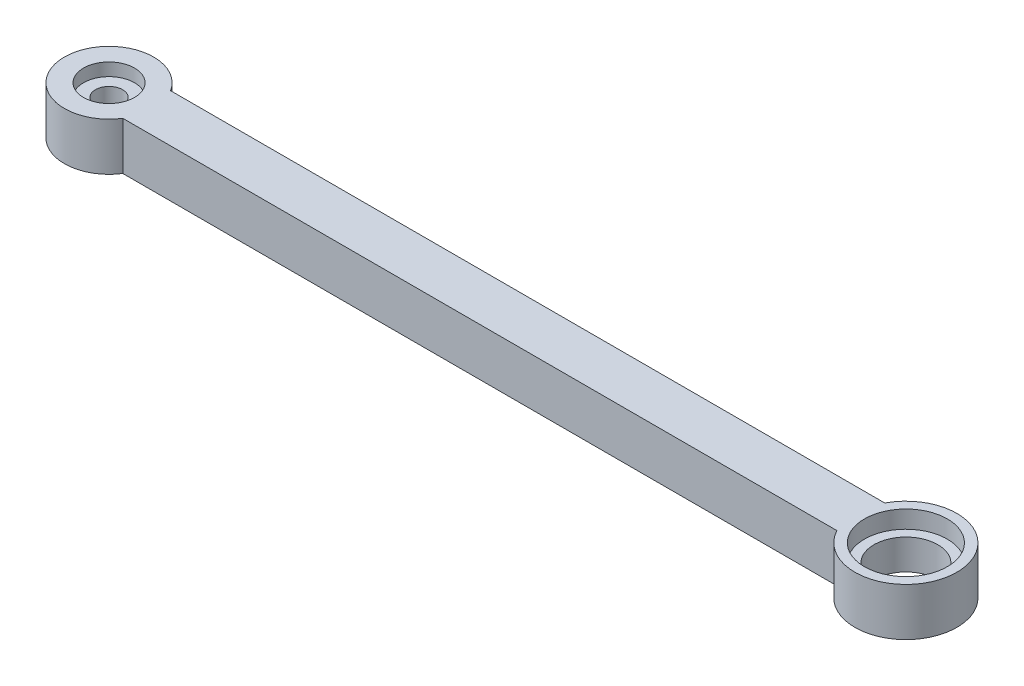
from build123d import *

# Parameters (mm, degrees)
SKETCH2_R                             = 14
SKETCH2_R_2                           = 8
BOSS_EXTRUDE7_DEPTH                   = 15
SKETCH2_9_R                           = 16
SKETCH2_9_R_2                         = 13
BOSS_EXTRUDE8_DEPTH                   = 15
SKETCH2_11_R                          = 13
SKETCH2_11_R_2                        = 10
BOSS_EXTRUDE9_DEPTH                   = 9.5
BOSS_EXTRUDE11_REACH                  = 219.372
BOSS_EXTRUDE11_END_RADIUS             = 14
BOSS_EXTRUDE11_DIRECTION_2_REACH      = 219.372
BOSS_EXTRUDE11_DIRECTION_2_END_RADIUS = 16
BOSS_EXTRUDE12_REACH                  = 219.489
SKETCH15_W                            = 3
SKETCH15_H                            = 9.5
FILLET1_R                             = 2
SKETCH2_13_R                          = 8
SKETCH2_13_R_2                        = 4.25
BOSS_EXTRUDE13_DEPTH                  = 11


with BuildPart() as part:
    # Sketch2 → Boss-Extrude7 (new body)
    with BuildSketch(Plane(origin=(0, 0, 0), x_dir=(1, 0, 0), z_dir=(0, 1, 0))):
        with Locations(Location((-50, 3.220631283, 0), (0, 0, 270))):
            Circle(SKETCH2_R)
        with Locations(Location((-50, 3.220631283, 0), (0, 0, 270))):
            Circle(SKETCH2_R_2, mode=Mode.SUBTRACT)
    extrude(amount=BOSS_EXTRUDE7_DEPTH)


with BuildPart() as body_2:
    # Sketch2<9> → Boss-Extrude8 (new body)
    with BuildSketch(Plane(origin=(0, 0, 0), x_dir=(1, 0, 0), z_dir=(0, 1, 0))):
        with Locations(Location((200, 3.220631283, 0), (0, 0, 270))):
            Circle(SKETCH2_9_R)
        with Locations(Location((200, 3.220631283, 0), (0, 0, 270))):
            Circle(SKETCH2_9_R_2, mode=Mode.SUBTRACT)
    extrude(amount=BOSS_EXTRUDE8_DEPTH)

    # Sketch2<11> → Boss-Extrude9 (add)
    with BuildSketch(Plane(origin=(0, 0, 0), x_dir=(1, 0, 0), z_dir=(0, 1, 0))):
        with Locations(Location((200, 3.220631283, 0), (0, 0, 270))):
            Circle(SKETCH2_11_R)
        with Locations(Location((200, 3.220631283, 0), (0, 0, 270))):
            Circle(SKETCH2_11_R_2, mode=Mode.SUBTRACT)
    extrude(amount=BOSS_EXTRUDE9_DEPTH)


    add(part.part)  # Boss-Extrude11 merges part
    # Boss-Extrude11: up to this cylinder (the profile starts outside it)
    boss_extrude11_end = Plane(origin=(-50, 0.212132, -3.220631283), z_dir=(0, -1, 0)) * Cylinder(BOSS_EXTRUDE11_END_RADIUS, 467.744, mode=Mode.PRIVATE)
    # Sketch3 → Boss-Extrude11 (add, up to the surface)
    with BuildSketch(Plane(origin=(0, 0, 0), x_dir=(0, 0, -1), z_dir=(1, 0, 0)), mode=Mode.PRIVATE) as boss_extrude11_sk1:
        Polygon((10.720631283, 0), (10.720631283, 15), (-4.279368717, 15), (-4.279368717, 0), (-1.279368717, 0), (-1.279368717, 12), (7.720631283, 12), (7.720631283, 0), align=None)
    boss_extrude11_tool1 = extrude(boss_extrude11_sk1.sketch, amount=-BOSS_EXTRUDE11_REACH, mode=Mode.PRIVATE) - boss_extrude11_end
    add(boss_extrude11_tool1.solids().sort_by_distance((0, 0.212132, -9.220631))[0])

    # Boss-Extrude11 direction 2: up to this cylinder (the profile starts outside it)
    boss_extrude11_direction_2_end = Plane(origin=(200, 0.212132, -3.220631283), z_dir=(0, -1, 0)) * Cylinder(BOSS_EXTRUDE11_DIRECTION_2_END_RADIUS, 471.744, mode=Mode.PRIVATE)
    # Sketch3 → Boss-Extrude11 direction 2 (add, up to the surface)
    with BuildSketch(Plane(origin=(0, 0, 0), x_dir=(0, 0, -1), z_dir=(1, 0, 0)), mode=Mode.PRIVATE) as boss_extrude11_direction_2_sk1:
        Polygon((10.720631283, 0), (10.720631283, 15), (-4.279368717, 15), (-4.279368717, 0), (-1.279368717, 0), (-1.279368717, 12), (7.720631283, 12), (7.720631283, 0), align=None)
    boss_extrude11_direction_2_tool1 = extrude(boss_extrude11_direction_2_sk1.sketch, amount=BOSS_EXTRUDE11_DIRECTION_2_REACH, mode=Mode.PRIVATE) - boss_extrude11_direction_2_end
    add(boss_extrude11_direction_2_tool1.solids().sort_by_distance((0, 0.212132, -9.220631))[0])

    # Sketch15 → Boss-Extrude12 (add, up to next)
    with BuildSketch(Plane.XY.offset(-7.720631283), mode=Mode.PRIVATE) as boss_extrude12_sk1:
        with Locations((-14.45117452, 7.25)):
            Rectangle(SKETCH15_W, SKETCH15_H)
    boss_extrude12_tool1 = extrude(boss_extrude12_sk1.sketch, amount=BOSS_EXTRUDE12_REACH, mode=Mode.PRIVATE) - body_2.part
    # Sketch15 → Boss-Extrude12 (add, up to next)
    with BuildSketch(Plane.XY.offset(-7.720631283), mode=Mode.PRIVATE) as boss_extrude12_sk2:
        with Locations((86.457765729, 7.25)):
            Rectangle(SKETCH15_W, SKETCH15_H)
    boss_extrude12_tool2 = extrude(boss_extrude12_sk2.sketch, amount=BOSS_EXTRUDE12_REACH, mode=Mode.PRIVATE) - body_2.part
    # Sketch15 → Boss-Extrude12 (add, up to next)
    with BuildSketch(Plane.XY.offset(-7.720631283), mode=Mode.PRIVATE) as boss_extrude12_sk3:
        with Locations((10.776060542, 7.25)):
            Rectangle(SKETCH15_W, SKETCH15_H)
    boss_extrude12_tool3 = extrude(boss_extrude12_sk3.sketch, amount=BOSS_EXTRUDE12_REACH, mode=Mode.PRIVATE) - body_2.part
    # Sketch15 → Boss-Extrude12 (add, up to next)
    with BuildSketch(Plane.XY.offset(-7.720631283), mode=Mode.PRIVATE) as boss_extrude12_sk4:
        with Locations((36.003295604, 7.25)):
            Rectangle(SKETCH15_W, SKETCH15_H)
    boss_extrude12_tool4 = extrude(boss_extrude12_sk4.sketch, amount=BOSS_EXTRUDE12_REACH, mode=Mode.PRIVATE) - body_2.part
    # Sketch15 → Boss-Extrude12 (add, up to next)
    with BuildSketch(Plane.XY.offset(-7.720631283), mode=Mode.PRIVATE) as boss_extrude12_sk5:
        with Locations((61.230530666, 7.25)):
            Rectangle(SKETCH15_W, SKETCH15_H)
    boss_extrude12_tool5 = extrude(boss_extrude12_sk5.sketch, amount=BOSS_EXTRUDE12_REACH, mode=Mode.PRIVATE) - body_2.part
    # Sketch15 → Boss-Extrude12 (add, up to next)
    with BuildSketch(Plane.XY.offset(-7.720631283), mode=Mode.PRIVATE) as boss_extrude12_sk6:
        with Locations((111.685000791, 7.25)):
            Rectangle(SKETCH15_W, SKETCH15_H)
    boss_extrude12_tool6 = extrude(boss_extrude12_sk6.sketch, amount=BOSS_EXTRUDE12_REACH, mode=Mode.PRIVATE) - body_2.part
    # Sketch15 → Boss-Extrude12 (add, up to next)
    with BuildSketch(Plane.XY.offset(-7.720631283), mode=Mode.PRIVATE) as boss_extrude12_sk7:
        with Locations((136.912235853, 7.25)):
            Rectangle(SKETCH15_W, SKETCH15_H)
    boss_extrude12_tool7 = extrude(boss_extrude12_sk7.sketch, amount=BOSS_EXTRUDE12_REACH, mode=Mode.PRIVATE) - body_2.part
    # Sketch15 → Boss-Extrude12 (add, up to next)
    with BuildSketch(Plane.XY.offset(-7.720631283), mode=Mode.PRIVATE) as boss_extrude12_sk8:
        with Locations((162.139470915, 7.25)):
            Rectangle(SKETCH15_W, SKETCH15_H)
    boss_extrude12_tool8 = extrude(boss_extrude12_sk8.sketch, amount=BOSS_EXTRUDE12_REACH, mode=Mode.PRIVATE) - body_2.part
    add(boss_extrude12_tool1.solids().sort_by_distance((-14.451175, 7.25, -7.720631))[0])
    add(boss_extrude12_tool2.solids().sort_by_distance((86.457766, 7.25, -7.720631))[0])
    add(boss_extrude12_tool3.solids().sort_by_distance((10.776061, 7.25, -7.720631))[0])
    add(boss_extrude12_tool4.solids().sort_by_distance((36.003296, 7.25, -7.720631))[0])
    add(boss_extrude12_tool5.solids().sort_by_distance((61.230531, 7.25, -7.720631))[0])
    add(boss_extrude12_tool6.solids().sort_by_distance((111.685001, 7.25, -7.720631))[0])
    add(boss_extrude12_tool7.solids().sort_by_distance((136.912236, 7.25, -7.720631))[0])
    add(boss_extrude12_tool8.solids().sort_by_distance((162.139471, 7.25, -7.720631))[0])

    # Fillet1
    fillet1_edges = [body_2.edges().sort_by_distance(p)[0] for p in [
        (59.730530666, 7.25, 1.279368717),
        (62.730530666, 7.25, 1.279368717),
        (62.730530666, 7.25, -7.720631283),
        (59.730530666, 7.25, -7.720631283),
        (110.185000791, 7.25, 1.279368717),
        (113.185000791, 7.25, 1.279368717),
        (113.185000791, 7.25, -7.720631283),
        (110.185000791, 7.25, -7.720631283),
        (135.412235853, 7.25, 1.279368717),
        (138.412235853, 7.25, 1.279368717),
        (138.412235853, 7.25, -7.720631283),
        (135.412235853, 7.25, -7.720631283),
        (160.639470915, 7.25, 1.279368717),
        (163.639470915, 7.25, 1.279368717),
        (163.639470915, 7.25, -7.720631283),
        (160.639470915, 7.25, -7.720631283),
        (-15.95117452, 7.25, 1.279368717),
        (-12.95117452, 7.25, 1.279368717),
        (-12.95117452, 7.25, -7.720631283),
        (-15.95117452, 7.25, -7.720631283),
        (84.957765729, 7.25, 1.279368717),
        (87.957765729, 7.25, 1.279368717),
        (87.957765729, 7.25, -7.720631283),
        (84.957765729, 7.25, -7.720631283),
        (12.276060542, 7.25, 1.279368717),
        (9.276060542, 7.25, 1.279368717),
        (12.276060542, 7.25, -7.720631283),
        (9.276060542, 7.25, -7.720631283),
        (34.503295604, 7.25, 1.279368717),
        (37.503295604, 7.25, 1.279368717),
        (37.503295604, 7.25, -7.720631283),
        (34.503295604, 7.25, -7.720631283),
    ]]
    fillet(fillet1_edges, radius=FILLET1_R)

    # Sketch2<13> → Boss-Extrude13 (add)
    with BuildSketch(Plane(origin=(0, 0, 0), x_dir=(1, 0, 0), z_dir=(0, 1, 0))):
        with Locations(Location((-50, 3.220631283, 0), (0, 0, 270))):
            Circle(SKETCH2_13_R)
        with Locations(Location((-50, 3.220631283, 0), (0, 0, 270))):
            Circle(SKETCH2_13_R_2, mode=Mode.SUBTRACT)
    extrude(amount=BOSS_EXTRUDE13_DEPTH)


solid = body_2.part
